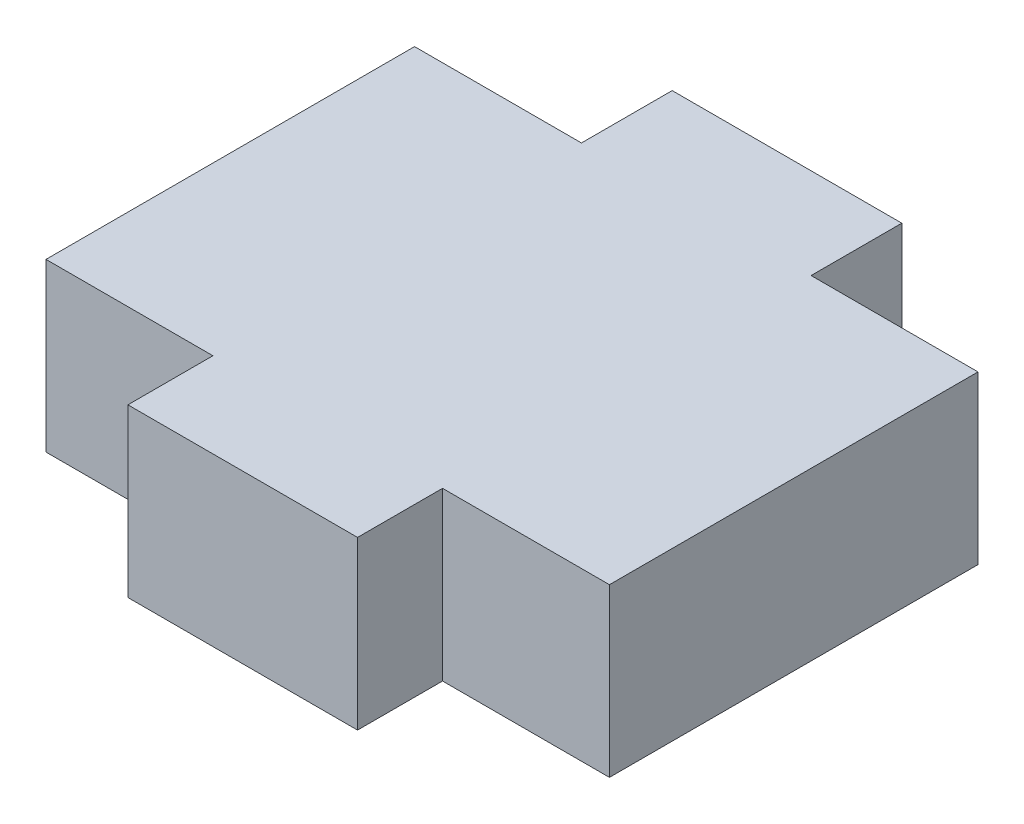
from build123d import *

# Parameters (mm, degrees)
BOSS_EXTRUDE1_DEPTH = 5.842


with BuildPart() as part:
    # Sketch1 → Boss-Extrude1 (new body)
    with BuildSketch(Plane(origin=(0, 0, 0), x_dir=(1, 0, 0), z_dir=(0, 1, 0))):
        Polygon((0, 0), (-8.0375, 0), (-8.0375, 2.975), (-13.8795, 2.975), (-13.8795, 15.875), (-8.0375, 15.875), (-8.0375, 19.05), (0, 19.05), (0, 15.875), (5.842, 15.875), (5.842, 2.975), (0, 2.975), align=None)
    extrude(amount=BOSS_EXTRUDE1_DEPTH)


solid = part.part
